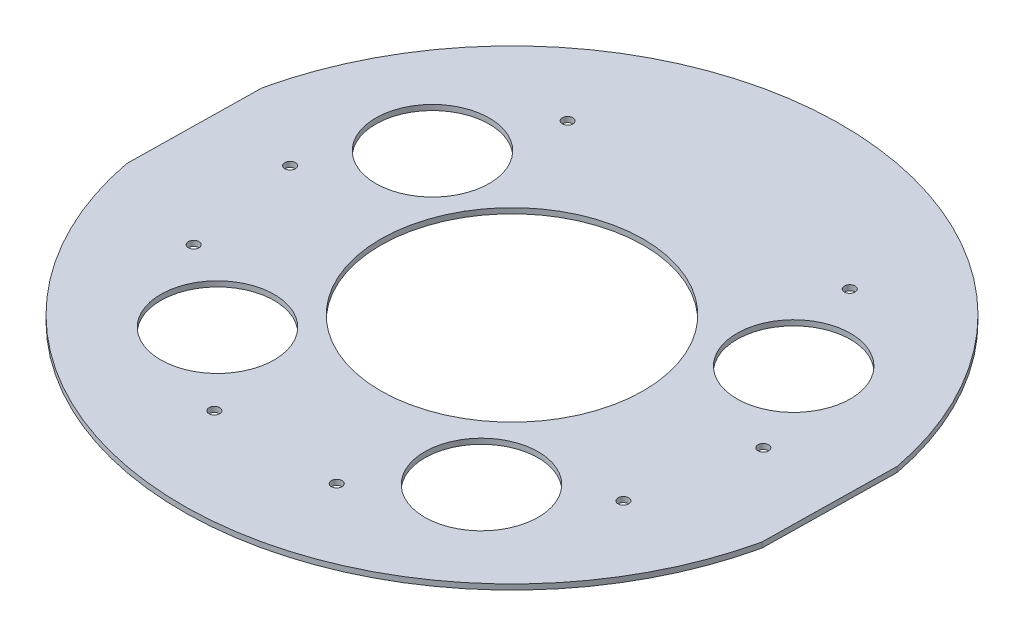
from build123d import *

# Parameters (mm, degrees)
SKETCH1_R           = 24.651
BOSS_EXTRUDE1_DEPTH = 1
SKETCH12_R          = 10.65
CUT_EXTRUDE11_DEPTH = 10
SKETCH17_R          = 1
CUT_EXTRUDE16_DEPTH = 12


with BuildPart() as part:
    # Sketch1 → Boss-Extrude1 (new body)
    with BuildSketch(Plane(origin=(0, 0, 0), x_dir=(-0.9998860245595664, 0, 0.015097612078282974), z_dir=(0, 1, 0))):
        with BuildLine():
            Line((16.709723735, 8.315025383), (15.933603805, -16.67292447))
            ThreePointArc((15.933603805, -16.67292447), (-46.108257418, -64.086707389), (-105.088045734, -12.914020093))
            Line((-105.088045734, -12.914020093), (-104.311925805, 12.07392976))
            ThreePointArc((-104.311925805, 12.07392976), (-42.270064581, 59.487712679), (16.709723735, 8.315025383))
        make_face()
        with Locations(Location((-44.189161, -2.299497355, 0), (0, 0, 89.134937682))):
            Circle(SKETCH1_R, mode=Mode.SUBTRACT)
    extrude(amount=BOSS_EXTRUDE1_DEPTH)

    # Sketch12 → Cut-Extrude11 (cut)
    with BuildSketch(Plane(origin=(0, 1, 0), x_dir=(1, 0, 0), z_dir=(0, 1, 0))):
        with Locations(Location((68.835159128, -27.448400712, 0), (0, 0, 270))):
            Circle(SKETCH12_R)
        with Locations(Location((18.50605331, -26.645502828, 0), (0, 0, 270))):
            Circle(SKETCH12_R)
        with Locations(Location((10.013422933, 22.180446939, 0), (0, 0, 270))):
            Circle(SKETCH12_R)
        with Locations(Location((78.880907759, 21.081807158, 0), (0, 0, 270))):
            Circle(SKETCH12_R)
    extrude(amount=-CUT_EXTRUDE11_DEPTH, mode=Mode.SUBTRACT)

    # Sketch17 → Cut-Extrude16 (cut)
    with BuildSketch(Plane(origin=(48.22803339, 1, -7.719999561), x_dir=(-0.9998727759206765, 0, -0.01595092388173346), z_dir=(0, 1, 0))):
        with Locations(Location((-7.662813984, 48.486882974, 0), (0, 0, 90.913959377))):
            Circle(SKETCH17_R)
        with Locations(Location((15.667378709, 48.486882974, 0), (0, 0, 90.913959377))):
            Circle(SKETCH17_R)
        with Locations(Location((44.967394337, 23.920411988, 0), (0, 0, 90.913959377))):
            Circle(SKETCH17_R)
        with Locations(Location((49.120943166, 2.107633512, 0), (0, 0, 90.913959377))):
            Circle(SKETCH17_R)
        with Locations(Location((30.899804125, -31.507727626, 0), (0, 0, 90.913959377))):
            Circle(SKETCH17_R)
        with Locations(Location((-22.895239399, -31.507727626, 0), (0, 0, 90.913959377))):
            Circle(SKETCH17_R)
        with Locations(Location((-41.116378441, 2.107633512, 0), (0, 0, 90.913959377))):
            Circle(SKETCH17_R)
        with Locations(Location((-36.962829611, 23.920411988, 0), (0, 0, 90.913959377))):
            Circle(SKETCH17_R)
    extrude(amount=-CUT_EXTRUDE16_DEPTH, mode=Mode.SUBTRACT)


solid = part.part
